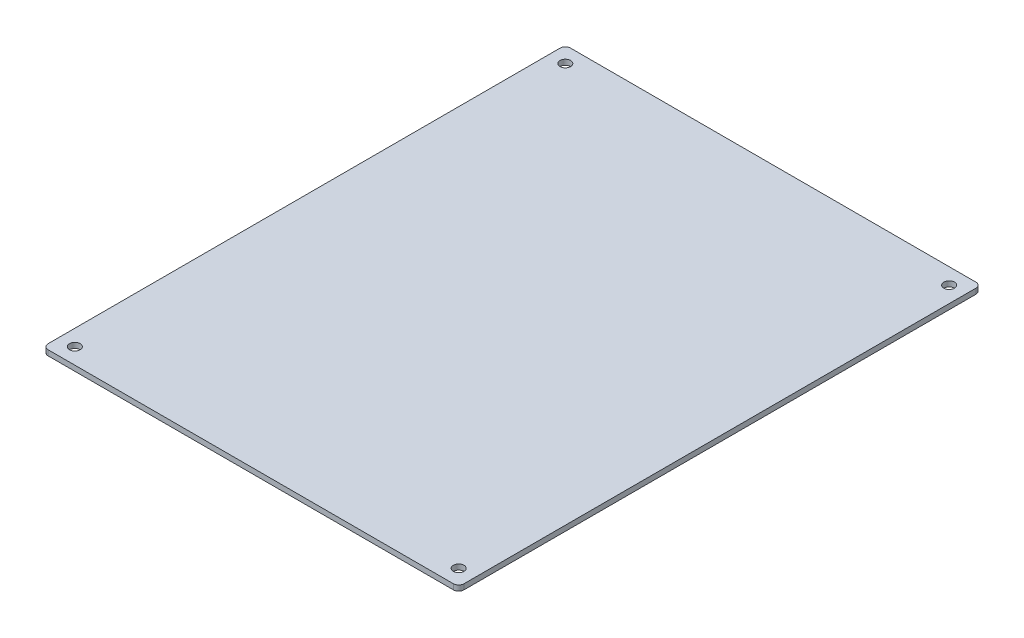
from build123d import *

# Parameters (mm, degrees)
SKETCH1_W           = 123.825
SKETCH1_H           = 155.575
SKETCH1_R           = 1.5875
BOSS_EXTRUDE1_DEPTH = 1.5875
FILLET1_R           = 1.5875


with BuildPart() as part:
    # Sketch1 → Boss-Extrude1 (new body)
    with BuildSketch(Plane(origin=(0, 0, 0), x_dir=(1, 0, 0), z_dir=(0, 1, 0))):
        with Locations((61.9125, 77.7875)):
            Rectangle(SKETCH1_W, SKETCH1_H)
        with Locations(Location((4.7625, 150.8125, 0), (0, 0, 270))):
            Circle(SKETCH1_R, mode=Mode.SUBTRACT)
        with Locations(Location((119.0625, 150.8125, 0), (0, 0, 270))):
            Circle(SKETCH1_R, mode=Mode.SUBTRACT)
        with Locations(Location((119.0625, 4.7625, 0), (0, 0, 270))):
            Circle(SKETCH1_R, mode=Mode.SUBTRACT)
        with Locations(Location((4.7625, 4.7625, 0), (0, 0, 270))):
            Circle(SKETCH1_R, mode=Mode.SUBTRACT)
    extrude(amount=BOSS_EXTRUDE1_DEPTH)

    # Fillet1
    fillet1_edges = [part.edges().sort_by_distance(p)[0] for p in [
        (0, 0.79375, -155.575),
        (123.825, 0.79375, -155.575),
        (123.825, 0.79375, 0),
        (0, 0.79375, 0),
    ]]
    fillet(fillet1_edges, radius=FILLET1_R)


solid = part.part
